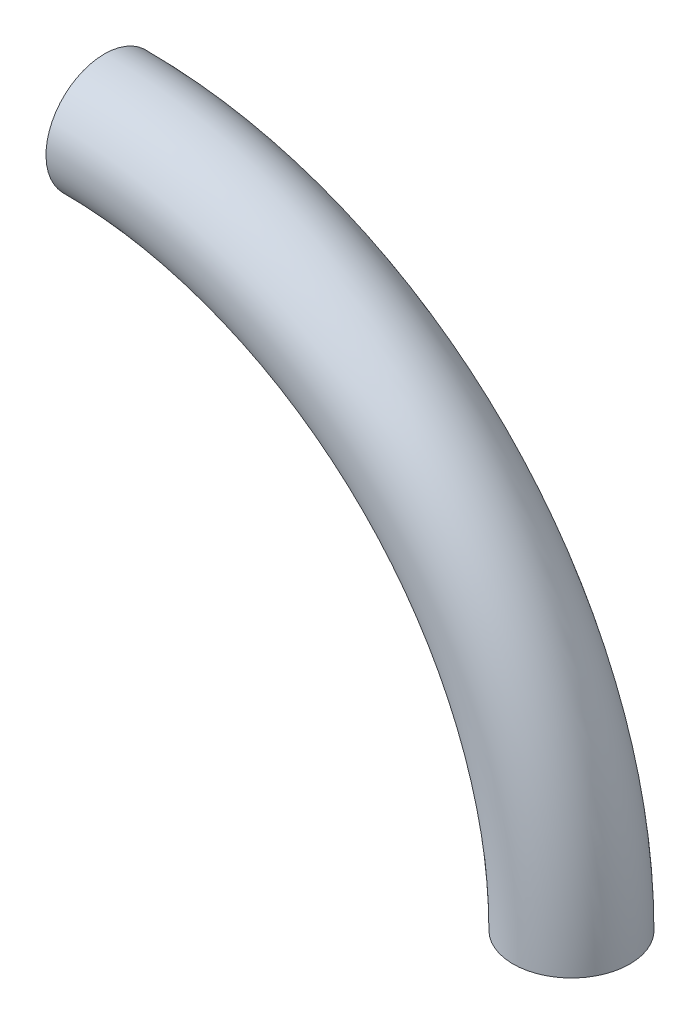
from build123d import *

# Parameters (mm, degrees)
SKETCH2_R   = 3.175
SKETCH2_R_2 = 2.159


with BuildPart() as part:
    # Sweep1: sweep along a path in Sketch1
    with BuildLine(Plane.XY) as sweep1_path:
        ThreePointArc((0, 0), (17.960512242, -7.439487758), (25.4, -25.4))
    # Sketch2 → Sweep1 (sweep)
    with BuildSketch(Plane(origin=(25.4, -25.4, 0), x_dir=(-1, 0, 0), z_dir=(0, -1, 0))):
        Circle(SKETCH2_R)
        Circle(SKETCH2_R_2, mode=Mode.SUBTRACT)
    sweep(path=sweep1_path.line)


solid = part.part
